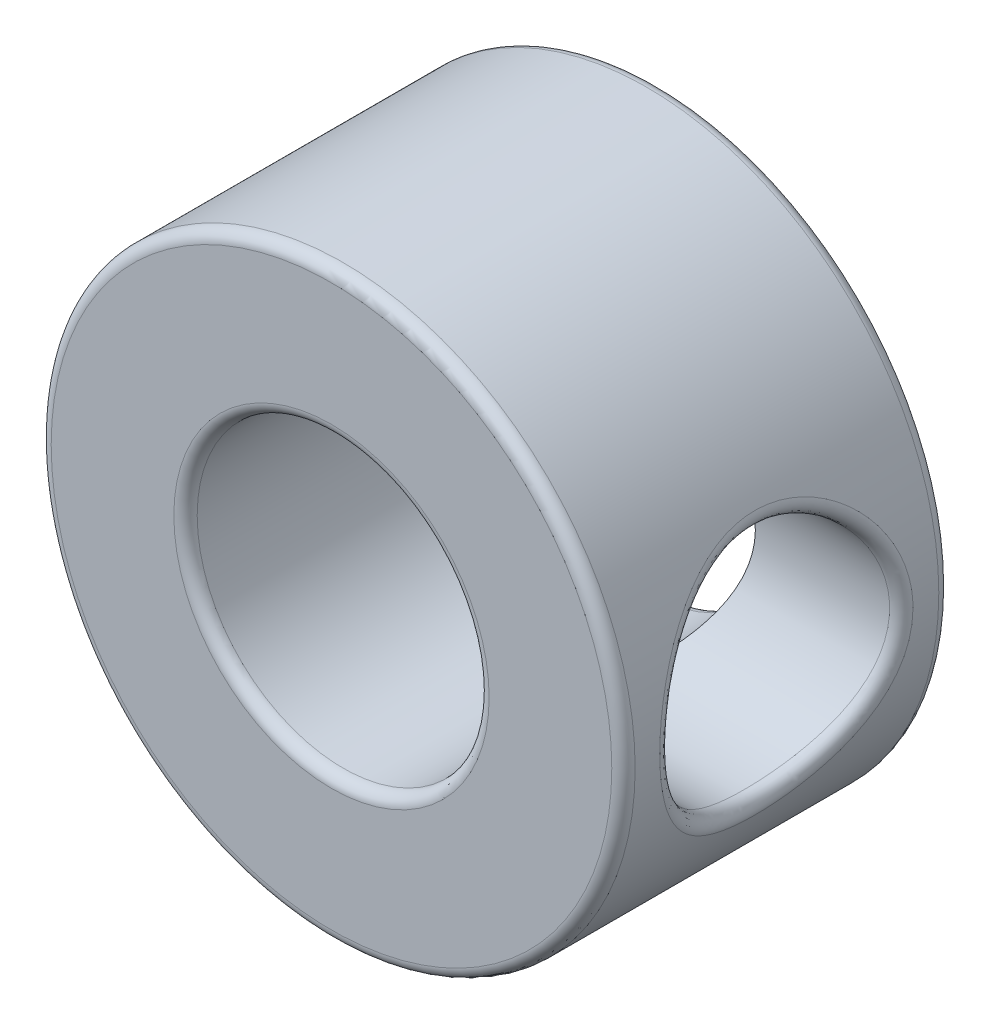
from build123d import *

# Parameters (mm, degrees)
SKETCH2_R           = 6.35
BOSS_EXTRUDE1_DEPTH = 7.112
SKETCH3_R           = 3.175
CUT_EXTRUDE1_DEPTH  = 19.05
SKETCH4_R           = 2.499999953
CUT_EXTRUDE2_DEPTH  = 19.05
FILLET1_R           = 0.254


with BuildPart() as part:
    # Sketch2 → Boss-Extrude1 (new body)
    with BuildSketch(Plane.XY):
        Circle(SKETCH2_R)
    extrude(amount=BOSS_EXTRUDE1_DEPTH)

    # Sketch3 → Cut-Extrude1 (cut)
    with BuildSketch(Plane.XY.offset(7.112)):
        Circle(SKETCH3_R)
    extrude(amount=-CUT_EXTRUDE1_DEPTH, mode=Mode.SUBTRACT)

    # Sketch4 → Cut-Extrude2 (cut)
    with BuildSketch(Plane(origin=(0, 0, 0), x_dir=(0, 0, -1), z_dir=(1, 0, 0))):
        with Locations(Location((-3.5687, 0, 0), (0, 0, 180))):
            Circle(SKETCH4_R)
    extrude(amount=CUT_EXTRUDE2_DEPTH, mode=Mode.SUBTRACT)

    # Fillet1
    fillet1_edges = [part.edges().sort_by_distance(p)[0] for p in [
        (5.837165428, 2.499999953, 3.5687),
        (-6.35, 0, 0),
        (-6.35, 0, 7.112),
        (-3.175, 0, 0),
        (-3.175, 0, 7.112),
    ]]
    fillet(fillet1_edges, radius=FILLET1_R)


solid = part.part
